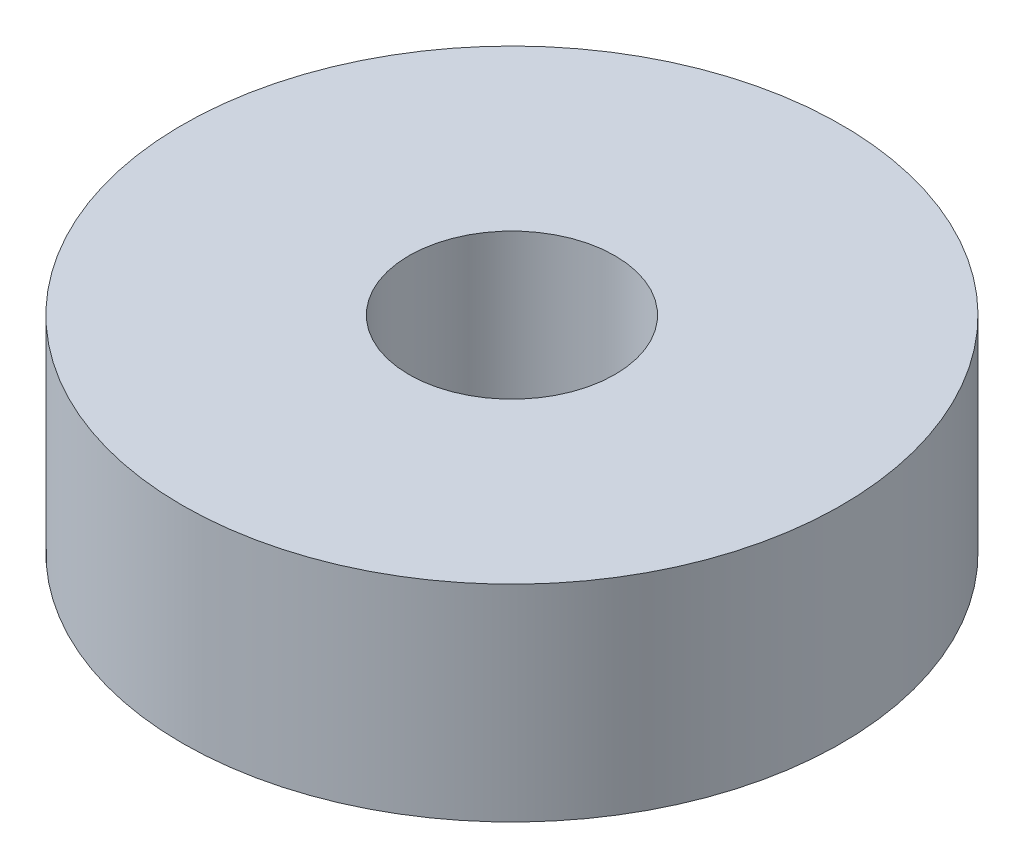
from build123d import *

# Parameters (mm, degrees)
SZKIC1_R                    = 8
SZKIC1_R_2                  = 2.5
DODANIE_WYCI_GNI_CIE1_DEPTH = 5


with BuildPart() as part:
    # Szkic1 → Dodanie-wyciągnięcie1 (new body)
    with BuildSketch(Plane(origin=(0, 0, 0), x_dir=(1, 0, 0), z_dir=(0, 1, 0))):
        with Locations(Location((0, 0, 0), (0, 0, 270))):
            Circle(SZKIC1_R)
        with Locations(Location((0, 0, 0), (0, 0, 270))):
            Circle(SZKIC1_R_2, mode=Mode.SUBTRACT)
    extrude(amount=DODANIE_WYCI_GNI_CIE1_DEPTH)


solid = part.part
